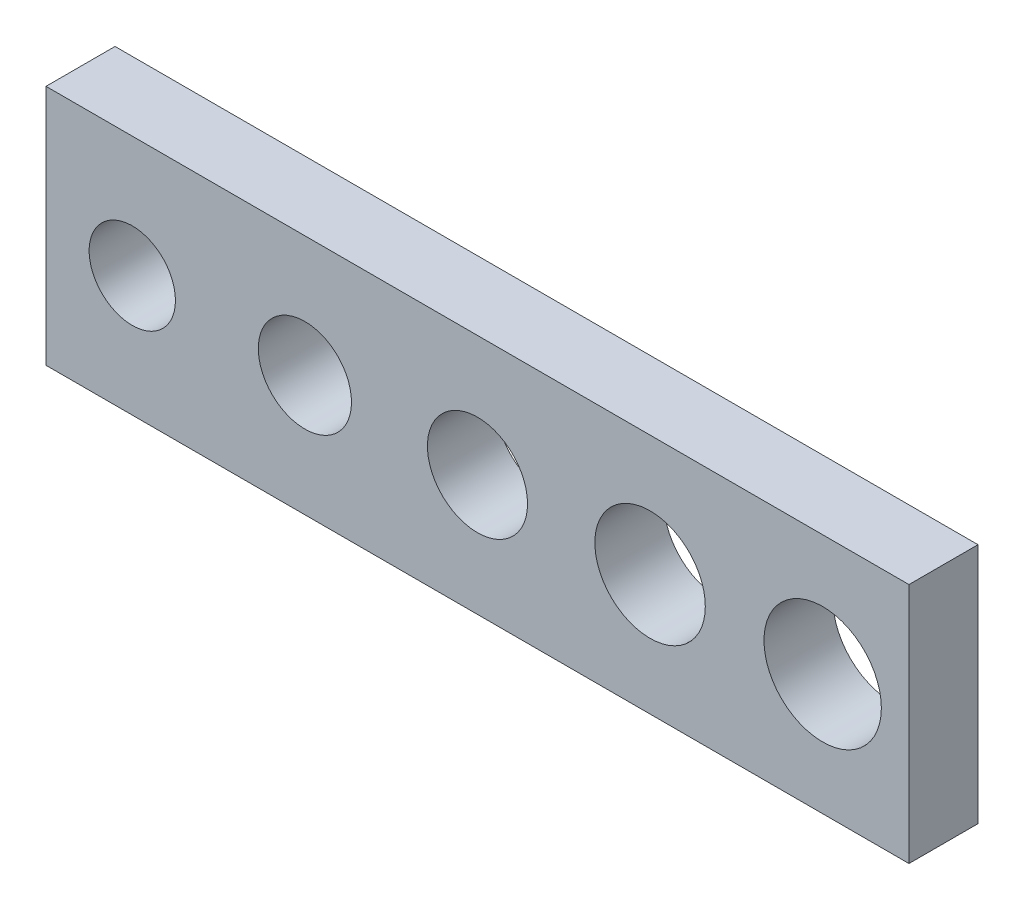
from build123d import *

# Parameters (mm, degrees)
SKETCH1_W           = 63.5
SKETCH1_H           = 17.78
SKETCH1_R           = 3.175
SKETCH1_R_2         = 3.429
SKETCH1_R_3         = 3.683
SKETCH1_R_4         = 4.064
SKETCH1_R_5         = 4.318
BOSS_EXTRUDE1_DEPTH = 5.08


with BuildPart() as part:
    # Sketch1 → Boss-Extrude1 (new body)
    with BuildSketch(Plane.XY):
        with Locations((31.75, 8.89)):
            Rectangle(SKETCH1_W, SKETCH1_H)
        with Locations((6.35, 8.89)):
            Circle(SKETCH1_R, mode=Mode.SUBTRACT)
        with Locations((19.05, 8.89)):
            Circle(SKETCH1_R_2, mode=Mode.SUBTRACT)
        with Locations((31.75, 8.89)):
            Circle(SKETCH1_R_3, mode=Mode.SUBTRACT)
        with Locations((44.45, 8.89)):
            Circle(SKETCH1_R_4, mode=Mode.SUBTRACT)
        with Locations((57.15, 8.89)):
            Circle(SKETCH1_R_5, mode=Mode.SUBTRACT)
    extrude(amount=BOSS_EXTRUDE1_DEPTH)


solid = part.part
